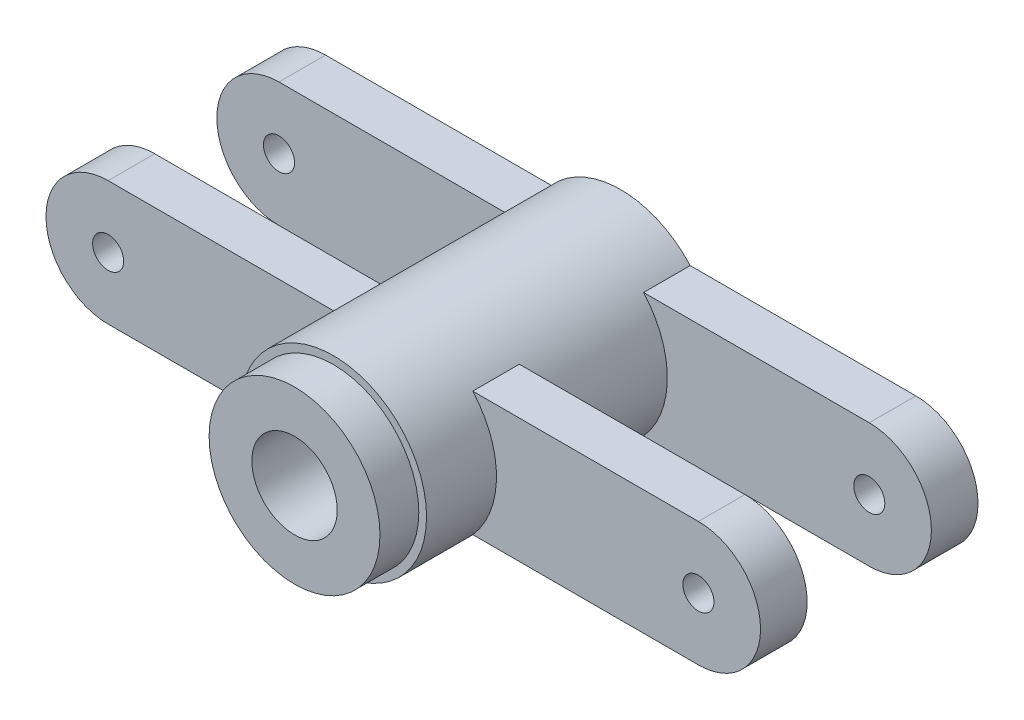
from build123d import *

# Parameters (mm, degrees)
SKETCH_1_R          = 6
EXTRUDE_1_DEPTH     = 11
EXTRUDE_2_DEPTH     = 3
EXTRUDE_3_DEPTH     = 3
SKETCH_5_R          = 6
EXTRUDE_4_DEPTH     = 10
SKETCH_6_R          = 1.5
CUT_EXTRUDE_1_DEPTH = 32.717503054
CUT_EXTRUDE_START   = -2.5
SKETCH_7_R          = 6
SKETCH_7_R_2        = 5.5
CUT_EXTRUDE_2_DEPTH = 2.5
SKETCH_8_R          = 1
CUT_EXTRUDE_3_DEPTH = 28.586228448
SKETCH_9_R          = 2.75
CUT_EXTRUDE_4_DEPTH = 5


with BuildPart() as part:
    # 草图1 → 凸台-拉伸1 (new body)
    with BuildSketch(Plane.XY):
        Circle(SKETCH_1_R)
    extrude(amount=EXTRUDE_1_DEPTH)

    # 草图2 → 凸台-拉伸2 (add)
    with BuildSketch(Plane.XY):
        with BuildLine():
            Line((-19, 4), (19, 4))
            ThreePointArc((19, 4), (23, 0), (19, -4))
            Line((19, -4), (-19, -4))
            ThreePointArc((-19, -4), (-23, 0), (-19, 4))
        make_face()
    extrude(amount=EXTRUDE_2_DEPTH)

    # 草图3 → 凸台-拉伸3 (add)
    with BuildSketch(Plane.XY.offset(11)):
        with BuildLine():
            Line((-19, 4), (19, 4))
            ThreePointArc((19, 4), (23, 0), (19, -4))
            Line((19, -4), (-19, -4))
            ThreePointArc((-19, -4), (-23, 0), (-19, 4))
        make_face()
    extrude(amount=EXTRUDE_3_DEPTH)

    # 草图5 → 凸台-拉伸4 (add)
    with BuildSketch(Plane.XY.offset(11)):
        with Locations(Location((0, 0, 0), (0, 0, 221.810314896))):
            Circle(SKETCH_5_R)
    extrude(amount=EXTRUDE_4_DEPTH)

    # 草图6 → 切除-拉伸1 (cut, through all)
    with BuildSketch(Plane(origin=(0, 0, 0), x_dir=(-1, 0, 0), z_dir=(0, 0, -1))):
        Circle(SKETCH_6_R)
    extrude(amount=-CUT_EXTRUDE_1_DEPTH, mode=Mode.SUBTRACT)

    # 草图7 → 切除-拉伸2 (cut)
    with BuildSketch(Plane.XY.offset(21).offset(CUT_EXTRUDE_START)):
        with Locations(Location((0, 0, 0), (0, 0, 221.810314896))):
            Circle(SKETCH_7_R)
        Circle(SKETCH_7_R_2, mode=Mode.SUBTRACT)
    extrude(amount=CUT_EXTRUDE_2_DEPTH, mode=Mode.SUBTRACT)

    # 草图8 → 切除-拉伸3 (cut, through all)
    with BuildSketch(Plane.XY.offset(14)):
        with Locations((-19, 0)):
            Circle(SKETCH_8_R)
        with Locations((19, 0)):
            Circle(SKETCH_8_R)
    extrude(amount=-CUT_EXTRUDE_3_DEPTH, mode=Mode.SUBTRACT)

    # 草图9 → 切除-拉伸4 (cut)
    with BuildSketch(Plane.XY.offset(21)):
        Circle(SKETCH_9_R)
    extrude(amount=-CUT_EXTRUDE_4_DEPTH, mode=Mode.SUBTRACT)


solid = part.part
